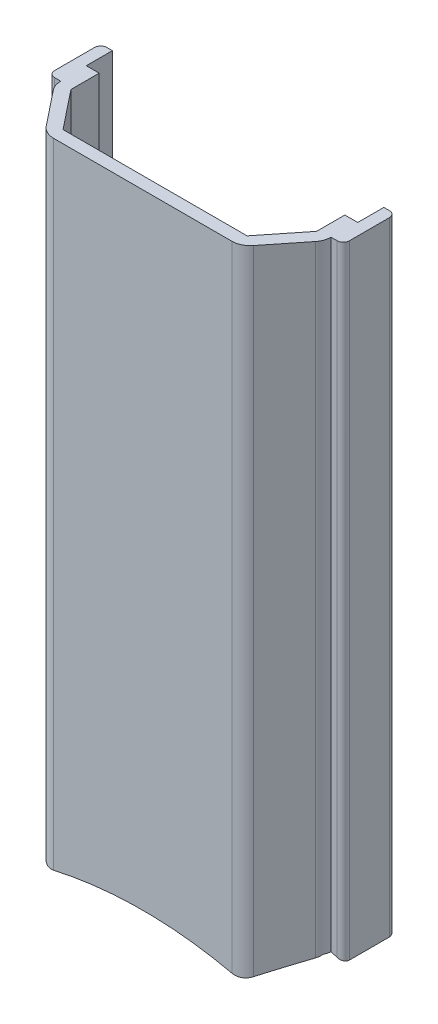
from build123d import *

# Parameters (mm, degrees)
EXTRUDE_1_DEPTH     = 58.89737674
EXTRUDE_START       = 38.399597665
EXTRUDE_2_DEPTH     = 38.399597665
EXTRUDE_3_REACH     = 66.893
SKETCH_3_W          = 44.2
SKETCH_3_H          = 3
EXTRUDE_4_REACH     = 66.893
SKETCH_4_W          = 44.2
SKETCH_4_H          = 3
CUT_EXTRUDE_START   = -77.29697691
CUT_EXTRUDE_1_DEPTH = 77.29697691
SKETCH_6_W          = 16.122631446
SKETCH_6_H          = 4.394864928
CUT_EXTRUDE_2_DEPTH = 3
EXTRUDE_START_2     = 15
EXTRUDE_5_DEPTH     = 15


with BuildPart() as part:
    # 草图1 → 凸台-拉伸1 (new body)
    with BuildSketch(Plane(origin=(0, 0, 0), x_dir=(1, 0, 0), z_dir=(0, 1, 0))):
        with BuildLine():
            Line((21.346642729, -10.719560241), (16.852020459, -16.362765964))
            ThreePointArc((16.852020459, -16.362765964), (15.807857901, -17.196247295), (14.505374257, -17.493741725))
            Line((14.505374257, -17.493741725), (-14.505381202, -17.493741725))
            ThreePointArc((-14.505381202, -17.493741725), (-15.807864846, -17.196247295), (-16.852027404, -16.362765964))
            Line((-16.852027404, -16.362765964), (-21.346649674, -10.719560241))
            ThreePointArc((-21.346649674, -10.719560241), (-21.831958504, -9.840501001), (-22.000003473, -8.850536003))
            Line((-22.000003473, -8.850536003), (-23.000003473, -8.850536003))
            ThreePointArc((-23.000003473, -8.850536003), (-23.707110254, -8.557642784), (-24.000003473, -7.850536003))
            Line((-24.000003473, -7.850536003), (-24.000003473, -1.349569462))
            ThreePointArc((-24.000003473, -1.349569462), (-23.707110254, -0.642462681), (-23.000003473, -0.349569462))
            Line((-23.000003473, -0.349569462), (-22.100003473, -0.349569462))
            Line((-22.100003473, -0.349569462), (-22.100003473, -4.600052733))
            Line((-22.100003473, -4.600052733), (-22.000003473, -4.600052733))
            Line((-22.000003473, -4.600052733), (-20.000003473, -4.600052733))
            Line((-20.000003473, -4.600052733), (-20.000003473, -9.200105465))
            Line((-20.000003473, -9.200105465), (-14.987335304, -15.493741725))
            Line((-14.987335304, -15.493741725), (14.987328359, -15.493741725))
            Line((14.987328359, -15.493741725), (19.999996527, -9.200105465))
            Line((19.999996527, -9.200105465), (19.999996527, -4.600052733))
            Line((19.999996527, -4.600052733), (21.999996527, -4.600052733))
            Line((21.999996527, -4.600052733), (22.099996527, -4.600052733))
            Line((22.099996527, -4.600052733), (22.099996527, -0.349569462))
            Line((22.099996527, -0.349569462), (22.999996527, -0.349569462))
            ThreePointArc((22.999996527, -0.349569462), (23.707103309, -0.642462681), (23.999996527, -1.349569462))
            Line((23.999996527, -1.349569462), (23.999996527, -7.850536003))
            ThreePointArc((23.999996527, -7.850536003), (23.707103309, -8.557642784), (22.999996527, -8.850536003))
            Line((22.999996527, -8.850536003), (21.999996527, -8.850536003))
            ThreePointArc((21.999996527, -8.850536003), (21.831951559, -9.840501001), (21.346642729, -10.719560241))
        make_face()
    extrude(amount=EXTRUDE_1_DEPTH)

    # 草图2 → 凸台-拉伸2 (add)
    with BuildSketch(Plane.XZ.offset(EXTRUDE_START)):
        with BuildLine():
            Line((22.999996527, 8.850536003), (21.999996527, 8.850536003))
            ThreePointArc((21.999996527, 8.850536003), (21.831951559, 9.840501001), (21.346642729, 10.719560241))
            Line((21.346642729, 10.719560241), (16.852020459, 16.362765964))
            ThreePointArc((16.852020459, 16.362765964), (15.807857901, 17.196247295), (14.505374257, 17.493741725))
            Line((14.505374257, 17.493741725), (-14.505381202, 17.493741725))
            ThreePointArc((-14.505381202, 17.493741725), (-15.807864846, 17.196247295), (-16.852027404, 16.362765964))
            Line((-16.852027404, 16.362765964), (-21.346649674, 10.719560241))
            ThreePointArc((-21.346649674, 10.719560241), (-21.831958504, 9.840501001), (-22.000003473, 8.850536003))
            Line((-22.000003473, 8.850536003), (-23.000003473, 8.850536003))
            ThreePointArc((-23.000003473, 8.850536003), (-23.707110254, 8.557642784), (-24.000003473, 7.850536003))
            Line((-24.000003473, 7.850536003), (-24.000003473, 1.349569462))
            ThreePointArc((-24.000003473, 1.349569462), (-23.707110254, 0.642462681), (-23.000003473, 0.349569462))
            Line((-23.000003473, 0.349569462), (-22.100003473, 0.349569462))
            Line((-22.100003473, 0.349569462), (-22.100003473, 4.600052733))
            Line((-22.100003473, 4.600052733), (-20.000003473, 4.600052733))
            Line((-20.000003473, 4.600052733), (-20.000003473, 9.200105465))
            Line((-20.000003473, 9.200105465), (-14.987335304, 15.493741725))
            Line((-14.987335304, 15.493741725), (14.987328359, 15.493741725))
            Line((14.987328359, 15.493741725), (19.999996527, 9.200105465))
            Line((19.999996527, 9.200105465), (19.999996527, 4.600052733))
            Line((19.999996527, 4.600052733), (22.099996527, 4.600052733))
            Line((22.099996527, 4.600052733), (22.099996527, 0.349569462))
            Line((22.099996527, 0.349569462), (22.999996527, 0.349569462))
            ThreePointArc((22.999996527, 0.349569462), (23.707103309, 0.642462681), (23.999996527, 1.349569462))
            Line((23.999996527, 1.349569462), (23.999996527, 7.850536003))
            ThreePointArc((23.999996527, 7.850536003), (23.707103309, 8.557642784), (22.999996527, 8.850536003))
        make_face()
    extrude(amount=-EXTRUDE_2_DEPTH)

    # 凸台-拉伸3: up to this face of the body (flat: up to its plane)
    extrude_3_end = Plane(part.part.faces().sort_by_distance((-3.473e-06, 10.248889538, 17.493741725))[0])
    # 草图3 → 凸台-拉伸3 (add, up to the picked face)
    with BuildSketch(Plane(origin=(0, 0, 4.600052733), x_dir=(-1, 0, 0), z_dir=(0, 0, -1)), mode=Mode.PRIVATE) as extrude_3_sk1:
        with Locations((3.473e-06, -36.899597665)):
            Rectangle(SKETCH_3_W, SKETCH_3_H)
    extrude_3_tool1 = split(extrude(extrude_3_sk1.sketch, amount=-EXTRUDE_3_REACH, mode=Mode.PRIVATE), bisect_by=extrude_3_end, keep=Keep.BOTH, mode=Mode.PRIVATE)
    add(extrude_3_tool1.solids().sort_by(Axis((-3e-06, -36.899598, 4.600053), (0, 0, 1)))[0])

    # 凸台-拉伸4: up to this face of the body (flat: up to its plane)
    extrude_4_end = Plane(part.part.faces().sort_by_distance((-3.473e-06, 9.499837909, 17.493741725))[0])
    # 草图4 → 凸台-拉伸4 (add, up to the picked face)
    with BuildSketch(Plane(origin=(0, 0, 4.600052733), x_dir=(-1, 0, 0), z_dir=(0, 0, -1)), mode=Mode.PRIVATE) as extrude_4_sk1:
        with Locations((3.473e-06, 37.397379245)):
            Rectangle(SKETCH_4_W, SKETCH_4_H)
    extrude_4_tool1 = split(extrude(extrude_4_sk1.sketch, amount=-EXTRUDE_4_REACH, mode=Mode.PRIVATE), bisect_by=extrude_4_end, keep=Keep.BOTH, mode=Mode.PRIVATE)
    add(extrude_4_tool1.solids().sort_by(Axis((-3e-06, 37.397379, 4.600053), (0, 0, 1)))[0])

    # 草图5 → 切除-拉伸1 (cut)
    with BuildSketch(Plane(origin=(0, 38.897379245, 0), x_dir=(1, 0, 0), z_dir=(0, 1, 0)).offset(CUT_EXTRUDE_START)):
        with BuildLine():
            Line((-22.100003473, -8.850536003), (-22.100003473, -17.493741725))
            Line((-22.100003473, -17.493741725), (-14.505381202, -17.493741725))
            ThreePointArc((-14.505381202, -17.493741725), (-15.807864846, -17.196247295), (-16.852027404, -16.362765964))
            Line((-16.852027404, -16.362765964), (-21.346649674, -10.719560241))
            ThreePointArc((-21.346649674, -10.719560241), (-21.831958504, -9.840501001), (-22.000003473, -8.850536003))
            Line((-22.000003473, -8.850536003), (-22.100003473, -8.850536003))
        make_face()
        with BuildLine():
            Line((14.505374257, -17.493741725), (22.099996527, -17.493741725))
            Line((22.099996527, -17.493741725), (22.099996527, -8.850536003))
            Line((22.099996527, -8.850536003), (21.999996527, -8.850536003))
            ThreePointArc((21.999996527, -8.850536003), (21.831951559, -9.840501001), (21.346642729, -10.719560241))
            Line((21.346642729, -10.719560241), (16.852020459, -16.362765964))
            ThreePointArc((16.852020459, -16.362765964), (15.807857901, -17.196247295), (14.505374257, -17.493741725))
        make_face()
    extrude(amount=CUT_EXTRUDE_1_DEPTH, mode=Mode.SUBTRACT)

    # 草图6 → 切除-拉伸2 (cut)
    with BuildSketch(Plane(origin=(0, 38.897379245, 0), x_dir=(1, 0, 0), z_dir=(0, 1, 0))):
        with Locations((0, -9.597483264)):
            Rectangle(SKETCH_6_W, SKETCH_6_H)
    extrude(amount=-CUT_EXTRUDE_2_DEPTH, mode=Mode.SUBTRACT)

    # 草图7 → 凸台-拉伸5 (add)
    with BuildSketch(Plane(origin=(0, -38.399597665, 0), x_dir=(-1, 0, 0), z_dir=(0, -1, 0)).offset(EXTRUDE_START_2)):
        with BuildLine():
            Line((20.000003473, -4.600052733), (20.000003473, -9.200105465))
            Line((20.000003473, -9.200105465), (14.987335304, -15.493741725))
            Line((14.987335304, -15.493741725), (-14.987328359, -15.493741725))
            Line((-14.987328359, -15.493741725), (-19.999996527, -9.200105465))
            Line((-19.999996527, -9.200105465), (-19.999996527, -4.600052733))
            Line((-19.999996527, -4.600052733), (-21.999996527, -4.600052733))
            Line((-21.999996527, -4.600052733), (-22.099996527, -4.600052733))
            Line((-22.099996527, -4.600052733), (-22.099996527, -0.349569462))
            Line((-22.099996527, -0.349569462), (-22.999996527, -0.349569462))
            ThreePointArc((-22.999996527, -0.349569462), (-23.707103309, -0.642462681), (-23.999996527, -1.349569462))
            Line((-23.999996527, -1.349569462), (-23.999996527, -7.850536003))
            ThreePointArc((-23.999996527, -7.850536003), (-23.707103309, -8.557642784), (-22.999996527, -8.850536003))
            Line((-22.999996527, -8.850536003), (-21.999996527, -8.850536003))
            ThreePointArc((-21.999996527, -8.850536003), (-21.831951559, -9.840501001), (-21.346642729, -10.719560241))
            Line((-21.346642729, -10.719560241), (-16.852020459, -16.362765964))
            ThreePointArc((-16.852020459, -16.362765964), (-15.807857901, -17.196247295), (-14.505374257, -17.493741725))
            Line((-14.505374257, -17.493741725), (14.505381202, -17.493741725))
            ThreePointArc((14.505381202, -17.493741725), (15.807864846, -17.196247295), (16.852027404, -16.362765964))
            Line((16.852027404, -16.362765964), (21.346649674, -10.719560241))
            ThreePointArc((21.346649674, -10.719560241), (21.831958504, -9.840501001), (22.000003473, -8.850536003))
            Line((22.000003473, -8.850536003), (23.000003473, -8.850536003))
            ThreePointArc((23.000003473, -8.850536003), (23.707110254, -8.557642784), (24.000003473, -7.850536003))
            Line((24.000003473, -7.850536003), (24.000003473, -1.349569462))
            ThreePointArc((24.000003473, -1.349569462), (23.707110254, -0.642462681), (23.000003473, -0.349569462))
            Line((23.000003473, -0.349569462), (22.100003473, -0.349569462))
            Line((22.100003473, -0.349569462), (22.100003473, -4.600052733))
            Line((22.100003473, -4.600052733), (22.000003473, -4.600052733))
            Line((22.000003473, -4.600052733), (20.000003473, -4.600052733))
        make_face()
    extrude(amount=-EXTRUDE_5_DEPTH)

    # 草图8 → 切除-旋转1 (revolve, cut)
    with BuildSketch(Plane(origin=(0, 0, 0), x_dir=(0, 0, -1), z_dir=(1, 0, 0))):
        Polygon((-9.89924439, -38.299597665), (-20.291549236, -44.299597665), (-20.291549236, -55.801852499), (11.09144377, -55.801852499), (11.09144377, -44.299597665), (0.699138925, -38.299597665), align=None)
    revolve(axis=Axis((0, -108.399597665, 9.89924439), (0, 0, -1)), mode=Mode.SUBTRACT)


solid = part.part
